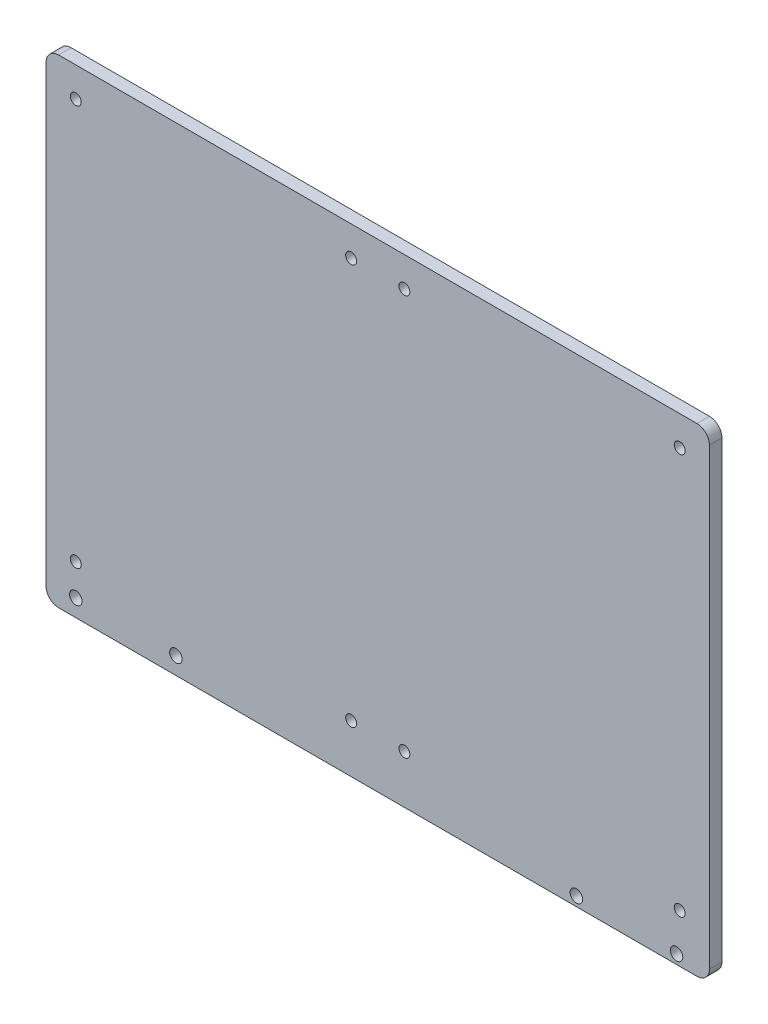
from build123d import *

# Parameters (mm, degrees)
SKETCH1_W           = 212
SKETCH1_H           = 153
SKETCH1_R           = 1.75
SKETCH1_R_2         = 2
BOSS_EXTRUDE1_DEPTH = 4
FILLET1_R           = 4


with BuildPart() as part:
    # Sketch1 → Boss-Extrude1 (new body)
    with BuildSketch(Plane.XY):
        Rectangle(SKETCH1_W, SKETCH1_H)
        with Locations((-96.5, -61)):
            Circle(SKETCH1_R, mode=Mode.SUBTRACT)
        with Locations(Location((-8.5, -61, 0), (0, 0, 180))):
            Circle(SKETCH1_R, mode=Mode.SUBTRACT)
        with Locations((8.5, -61)):
            Circle(SKETCH1_R, mode=Mode.SUBTRACT)
        with Locations(Location((96.5, -61, 0), (0, 0, 180))):
            Circle(SKETCH1_R, mode=Mode.SUBTRACT)
        with Locations(Location((-96.5, 67, 0), (0, 0, 180))):
            Circle(SKETCH1_R, mode=Mode.SUBTRACT)
        with Locations((96.5, 67)):
            Circle(SKETCH1_R, mode=Mode.SUBTRACT)
        with Locations(Location((8.5, 67, 0), (0, 0, 180))):
            Circle(SKETCH1_R, mode=Mode.SUBTRACT)
        with Locations((-8.5, 67)):
            Circle(SKETCH1_R, mode=Mode.SUBTRACT)
        with Locations((-96.5, -71)):
            Circle(SKETCH1_R_2, mode=Mode.SUBTRACT)
        with Locations(Location((95.480310976, -73.51, 0), (0, 0, 180))):
            Circle(SKETCH1_R_2, mode=Mode.SUBTRACT)
        with Locations((-64.5, -71)):
            Circle(SKETCH1_R_2, mode=Mode.SUBTRACT)
        with Locations((63.480310976, -73.51)):
            Circle(SKETCH1_R_2, mode=Mode.SUBTRACT)
    extrude(amount=BOSS_EXTRUDE1_DEPTH)

    # Fillet1
    fillet1_edges = [part.edges().sort_by_distance(p)[0] for p in [
        (-106, 76.5, 2),
        (106, 76.5, 2),
        (106, -76.5, 2),
        (-106, -76.5, 2),
    ]]
    fillet(fillet1_edges, radius=FILLET1_R)


solid = part.part
